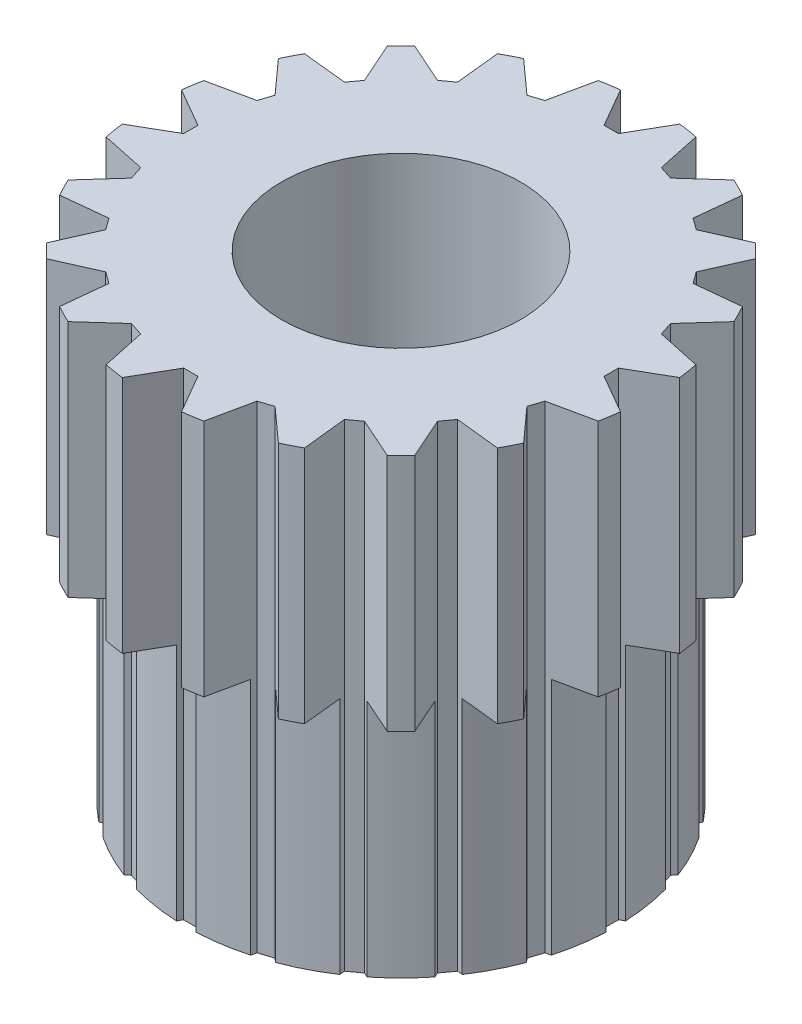
from build123d import *

# Parameters (mm, degrees)
SKETCH_1_R               = 4.5
EXTRUDE_1_DEPTH          = 10
SKETCH_2_R               = 5.25
EXTRUDE_2_DEPTH          = 5
CUT_EXTRUDE_3_DEPTH      = 10
PATTERN_CIRCULAR_2_COUNT = 20
SKETCH_5_R               = 2.5
CUT_EXTRUDE_4_DEPTH      = 10


with BuildPart() as part:
    # 스케치1 → 보스-돌출1 (new body)
    with BuildSketch(Plane(origin=(0, 0, 0), x_dir=(1, 0, 0), z_dir=(0, 1, 0))):
        with Locations(Location((0, 0, 0), (0, 0, 270))):
            Circle(SKETCH_1_R)
    extrude(amount=EXTRUDE_1_DEPTH)

    # 스케치2 → 보스-돌출2 (add)
    with BuildSketch(Plane(origin=(0, 10, 0), x_dir=(1, 0, 0), z_dir=(0, 1, 0))):
        with Locations(Location((0, 0, 0), (0, 0, 270))):
            Circle(SKETCH_2_R)
    extrude(amount=-EXTRUDE_2_DEPTH)

    # 스케치4 → 컷-돌출3 (cut)
    with BuildSketch(Plane(origin=(0, 10, 0), x_dir=(1, 0, 0), z_dir=(0, 1, 0))):
        Polygon((0, 4.4), (0.15, 4.4), (0.727350269, 5.4), (-0.727350269, 5.4), (-0.15, 4.4), align=None)
    cut_extrude_3 = extrude(amount=-CUT_EXTRUDE_3_DEPTH, mode=Mode.SUBTRACT)

    # 원형 패턴2: 컷-돌출3 ×20 about axis
    pattern_circular_2_axis = Axis((0, 0, 0), (0, 1, 0))
    for i in range(1, PATTERN_CIRCULAR_2_COUNT):
        add(cut_extrude_3.rotate(pattern_circular_2_axis, i * 360 / PATTERN_CIRCULAR_2_COUNT), mode=Mode.SUBTRACT)

    # 스케치5 → 컷-돌출4 (cut)
    with BuildSketch(Plane(origin=(0, 10, 0), x_dir=(1, 0, 0), z_dir=(0, 1, 0))):
        with Locations(Location((0, 0, 0), (0, 0, 270))):
            Circle(SKETCH_5_R)
    extrude(amount=-CUT_EXTRUDE_4_DEPTH, mode=Mode.SUBTRACT)


solid = part.part
